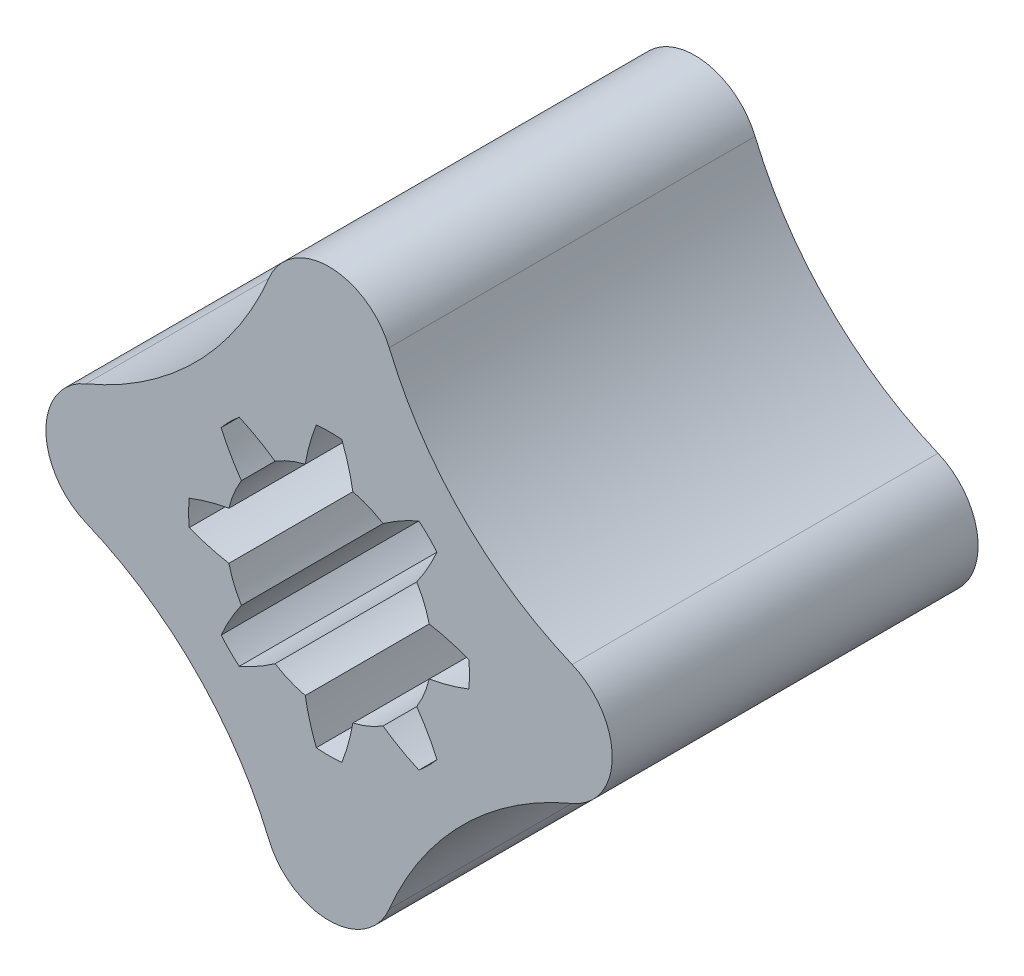
from build123d import *
from build123d.topology import SkipClean

# Parameters (mm, degrees)
SKETCH1_R         = 6
EXTRUDE1_DEPTH    = 21.5
EXTRUDE2_REACH    = 33.875
CIRPATTERN1_COUNT = 8


with BuildPart() as part:
    # Sketch1 → Extrude1 (new body)
    with BuildSketch(Plane.XY):
        with BuildLine():
            ThreePointArc((3.535156209, 14.285110262), (0, 16.64), (-3.535156209, 14.285110262))
            ThreePointArc((-3.535156209, 14.285110262), (-7.848885271, 7.848885271), (-14.285110262, 3.535156209))
            ThreePointArc((-14.285110262, 3.535156209), (-16.64, 0), (-14.285110262, -3.535156209))
            ThreePointArc((-14.285110262, -3.535156209), (-7.848885271, -7.848885271), (-3.535156209, -14.285110262))
            ThreePointArc((-3.535156209, -14.285110262), (0, -16.64), (3.535156209, -14.285110262))
            ThreePointArc((3.535156209, -14.285110262), (7.848885271, -7.848885271), (14.285110262, -3.535156209))
            ThreePointArc((14.285110262, -3.535156209), (16.64, 0), (14.285110262, 3.535156209))
            ThreePointArc((14.285110262, 3.535156209), (7.848885271, 7.848885271), (3.535156209, 14.285110262))
        make_face()
        Circle(SKETCH1_R, mode=Mode.SUBTRACT)
    extrude(amount=EXTRUDE1_DEPTH)

    # Sketch4 → Cut-Revolve1 (revolve, cut)
    with BuildSketch(Plane(origin=(0, 0, 0), x_dir=(0, 0, -1), z_dir=(1, 0, 0)), mode=Mode.PRIVATE) as cut_revolve1_sk:
        Polygon((0, 0), (-21.5, 0), (-21.5, 6.05), (-7.2, 6.05), (-5, 8.25), (0, 8.25), align=None)
    revolve(cut_revolve1_sk.sketch.rotate(Axis((0, 0, 0), (0, 0, 1)), 90), axis=Axis((0, 0, 0), (0, 0, 1)), mode=Mode.SUBTRACT)

    # Sketch2 → Extrude2 (cut, up to next)
    with BuildSketch(Plane(origin=(0, 0, 0), x_dir=(-1, 0, 0), z_dir=(0, 0, -1)), mode=Mode.PRIVATE) as extrude2_sk1:
        with BuildLine():
            ThreePointArc((0.75, 8.215838363), (0, 8.25), (-0.75, 8.215838363))
            ThreePointArc((-0.75, 8.215838363), (-1.133672744, 7.067180744), (-1.4, 5.885787968))
            ThreePointArc((-1.4, 5.885787968), (0, 6.05), (1.4, 5.885787968))
            ThreePointArc((1.4, 5.885787968), (1.133672744, 7.067180744), (0.75, 8.215838363))
        make_face()
    extrude2_tool1 = extrude(extrude2_sk1.sketch, amount=-EXTRUDE2_REACH, mode=Mode.PRIVATE) & part.part
    extrude2 = extrude2_tool1.solids().sort_by_distance((0, 7.008505, 0))[0]
    add(extrude2, mode=Mode.SUBTRACT)

    # CirPattern1: Extrude2 ×8 about axis
    with SkipClean():  # the faces are left unmerged after this step: merging them gives an invalid solid
        cirpattern1_axis = Axis((0, 0, 0), (0, 0, 1))
        for i in range(1, CIRPATTERN1_COUNT):
            add(extrude2.rotate(cirpattern1_axis, i * 360 / CIRPATTERN1_COUNT), mode=Mode.SUBTRACT)


solid = part.part
